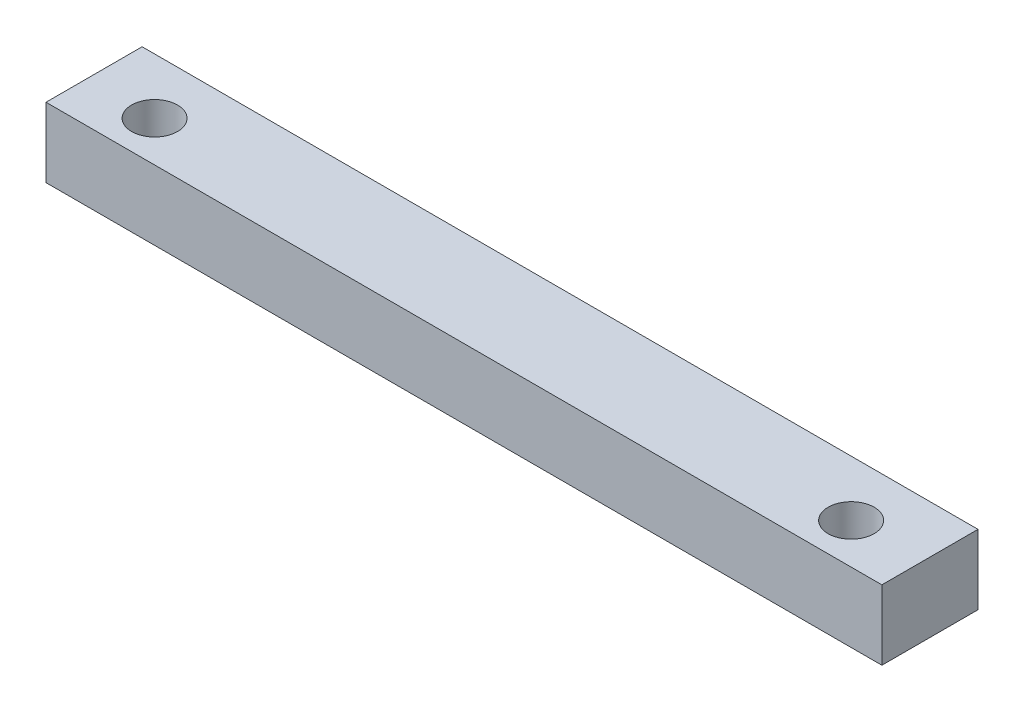
from build123d import *

# Parameters (mm, degrees)
SKETCH_1_W          = 60
SKETCH_1_H          = 6.9
EXTRUDE_1_DEPTH     = 5
SKETCH_2_R          = 1.65
CUT_EXTRUDE_1_DEPTH = 10


with BuildPart() as part:
    # 草图1 → 凸台-拉伸1 (new body)
    with BuildSketch(Plane(origin=(0, 0, 0), x_dir=(1, 0, 0), z_dir=(0, 1, 0))):
        with Locations((-12.970884588, 1.077948994)):
            Rectangle(SKETCH_1_W, SKETCH_1_H)
    extrude(amount=EXTRUDE_1_DEPTH)

    # 草图2 → 切除-拉伸1 (cut)
    with BuildSketch(Plane.XZ):
        with Locations(Location((11.923103363, -0.527948994, 0), (0, 0, 270))):
            Circle(SKETCH_2_R)
        with Locations(Location((-38.076896637, -0.527948994, 0), (0, 0, 270))):
            Circle(SKETCH_2_R)
    extrude(amount=-CUT_EXTRUDE_1_DEPTH, mode=Mode.SUBTRACT)


solid = part.part
